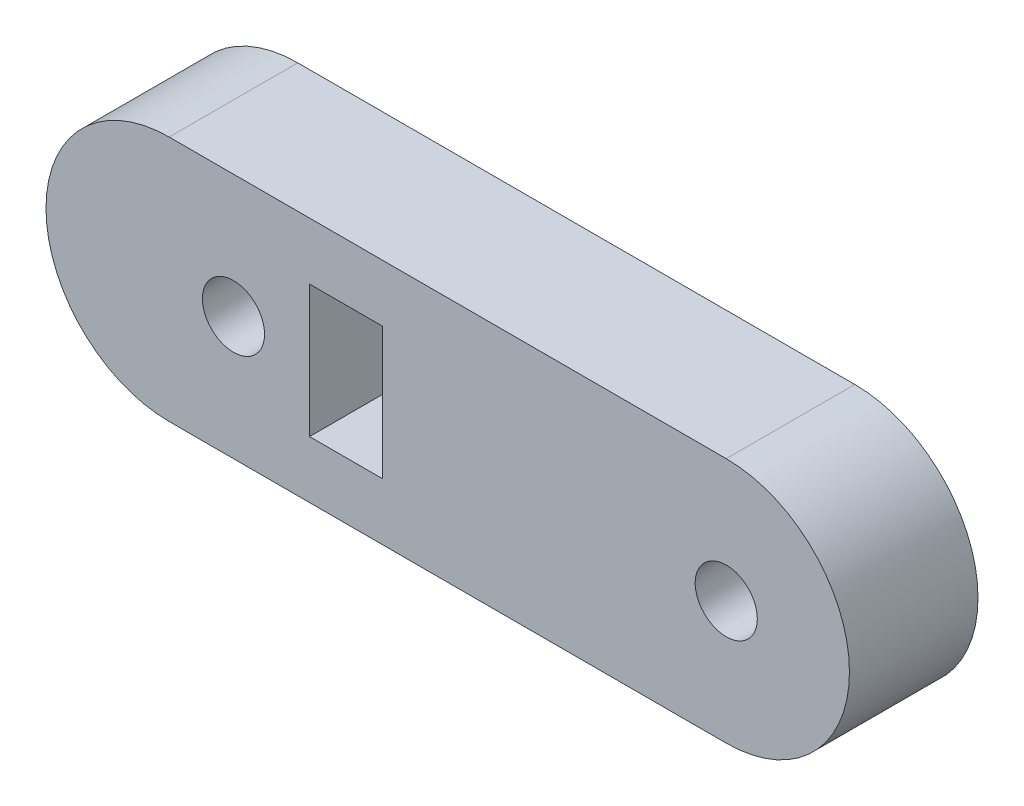
from build123d import *

# Parameters (mm, degrees)
SKETCH1_R           = 1.45
SKETCH1_W           = 3.4
SKETCH1_H           = 6.165
BOSS_EXTRUDE1_DEPTH = 6


with BuildPart() as part:
    # Sketch1 → Boss-Extrude1 (new body)
    with BuildSketch(Plane.XY):
        with BuildLine():
            Line((589.771388, 466.232899), (612.771388, 466.232899))
            ThreePointArc((612.771388, 466.232899), (618.521388, 460.482899), (612.771388, 454.732899))
            Line((612.771388, 454.732899), (589.771388, 454.732899))
            Line((589.771388, 454.732899), (586.771388, 454.732899))
            ThreePointArc((586.771388, 454.732899), (581.021388, 460.482899), (586.771388, 466.232899))
            Line((586.771388, 466.232899), (589.771388, 466.232899))
        make_face()
        with Locations((589.771388, 460.482899)):
            Circle(SKETCH1_R, mode=Mode.SUBTRACT)
        with Locations((612.771388, 460.482899)):
            Circle(SKETCH1_R, mode=Mode.SUBTRACT)
        with Locations((595.021388, 460.482899)):
            Rectangle(SKETCH1_W, SKETCH1_H, mode=Mode.SUBTRACT)
    extrude(amount=BOSS_EXTRUDE1_DEPTH)


solid = part.part
